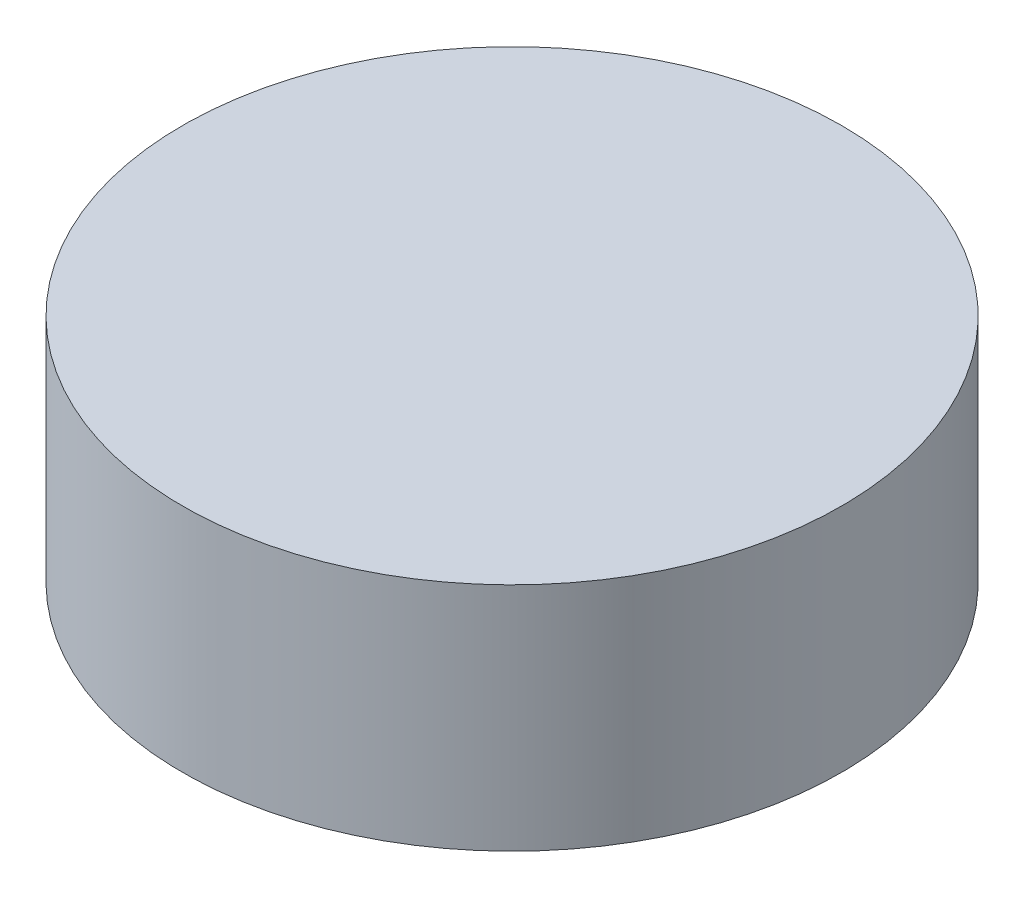
from build123d import *

# Parameters (mm, degrees)
SKTACOPVC3_R   = 20
TACOPVC3_DEPTH = 14


with BuildPart() as part:
    # SkTacoPVC3 → TacoPVC3 (new body)
    with BuildSketch(Plane(origin=(0, 18, 0), x_dir=(1, 0, 0), z_dir=(0, 1, 0))):
        with Locations(Location((-75, -129.903810568, 0), (0, 0, 90))):
            Circle(SKTACOPVC3_R)
    extrude(amount=TACOPVC3_DEPTH)


solid = part.part
